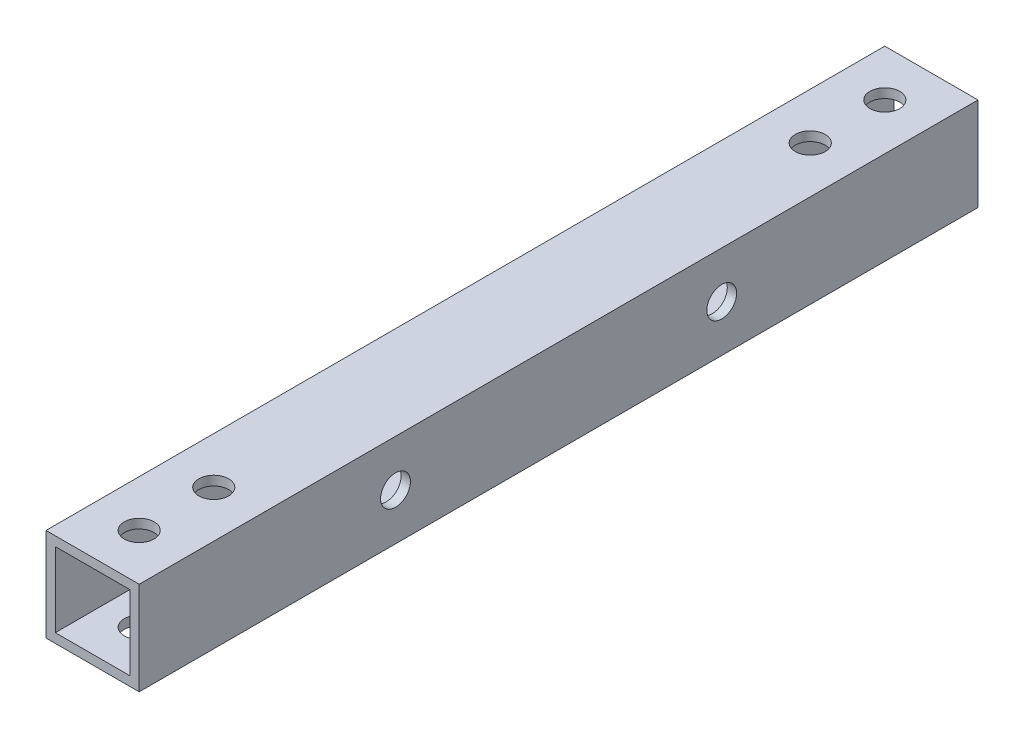
from build123d import *

# Parameters (mm, degrees)
SKETCH_282_W          = 10
SKETCH_282_H          = 10
SKETCH_282_W_2        = 8
SKETCH_282_H_2        = 8
EXTRUDE_339_DEPTH     = 90
SKETCH_411_R          = 1.6
CUT_EXTRUDE_834_DEPTH = 91.691785736
SKETCH_636_R          = 1.6
CUT_EXTRUDE_878_DEPTH = 91.691785736


with BuildPart() as part:
    # Sketch 282 → Extrude 339 (new body)
    with BuildSketch(Plane.XY):
        Rectangle(SKETCH_282_W, SKETCH_282_H)
        Rectangle(SKETCH_282_W_2, SKETCH_282_H_2, mode=Mode.SUBTRACT)
    extrude(amount=EXTRUDE_339_DEPTH)

    # Sketch 411 → Cut-Extrude 834 (cut, through all)
    with BuildSketch(Plane(origin=(0, 5, 0), x_dir=(1, 0, 0), z_dir=(0, 1, 0))):
        with Locations(Location((0, -5, 0), (0, 0, 270))):
            Circle(SKETCH_411_R)
        with Locations(Location((0, -85, 0), (0, 0, 270))):
            Circle(SKETCH_411_R)
        with Locations(Location((0, -13, 0), (0, 0, 270))):
            Circle(SKETCH_411_R)
        with Locations(Location((0, -77, 0), (0, 0, 270))):
            Circle(SKETCH_411_R)
    extrude(amount=-CUT_EXTRUDE_834_DEPTH, mode=Mode.SUBTRACT)

    # Sketch 636 → Cut-Extrude 878 (cut, through all)
    with BuildSketch(Plane(origin=(5, 0, 0), x_dir=(0, 0, -1), z_dir=(1, 0, 0))):
        with Locations((-27.5, 0)):
            Circle(SKETCH_636_R)
        with Locations((-62.5, 0)):
            Circle(SKETCH_636_R)
    extrude(amount=-CUT_EXTRUDE_878_DEPTH, mode=Mode.SUBTRACT)


solid = part.part
